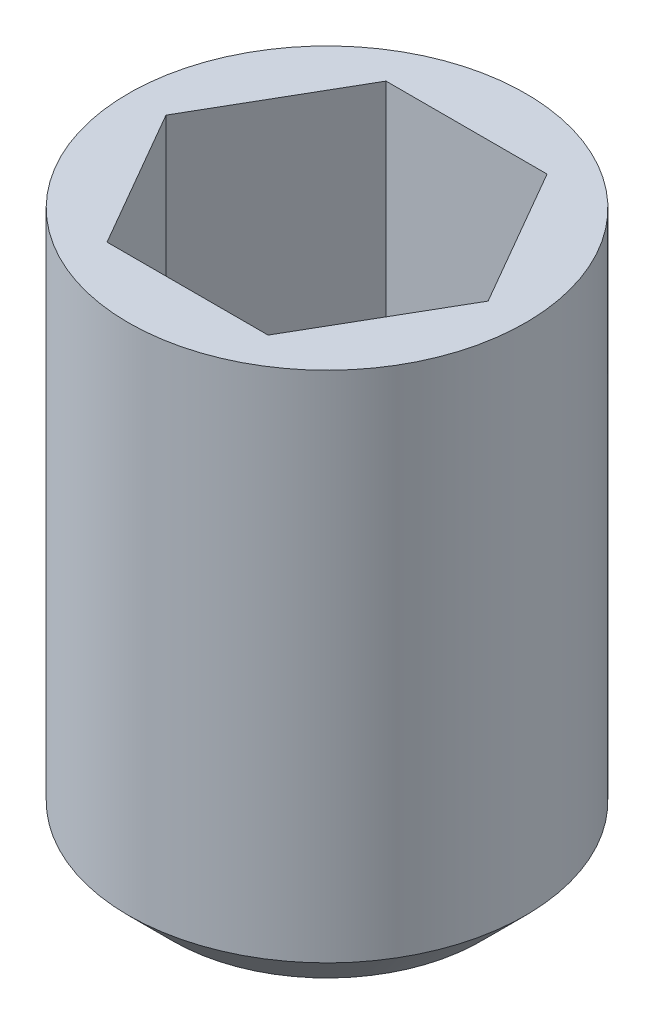
from build123d import *

# Parameters (mm, degrees)
SKETCH1_R           = 1.1303
BOSS_EXTRUDE1_DEPTH = 3.175
CHAMFER1_SIZE       = 0.254
CUT_EXTRUDE1_DEPTH  = 1.27


with BuildPart() as part:
    # Sketch1 → Boss-Extrude1 (new body)
    with BuildSketch(Plane(origin=(0, 0, 0), x_dir=(1, 0, 0), z_dir=(0, 1, 0))):
        with Locations(Location((0, 0, 0), (0, 0, 270))):
            Circle(SKETCH1_R)
    extrude(amount=-BOSS_EXTRUDE1_DEPTH)

    # Chamfer1
    chamfer1_edges = [part.edges().sort_by_distance(p)[0] for p in [
        (0, -3.175, -1.1303),
    ]]
    chamfer(chamfer1_edges, length=CHAMFER1_SIZE)

    # Sketch2 → Cut-Extrude1 (cut)
    with BuildSketch(Plane(origin=(0, 0, 0), x_dir=(1, 0, 0), z_dir=(0, 1, 0))):
        Polygon((-0.916543552, 0), (-0.458271776, -0.79375), (0.458271776, -0.79375), (0.916543552, 0), (0.458271776, 0.79375), (-0.458271776, 0.79375), align=None)
    extrude(amount=-CUT_EXTRUDE1_DEPTH, mode=Mode.SUBTRACT)


solid = part.part
